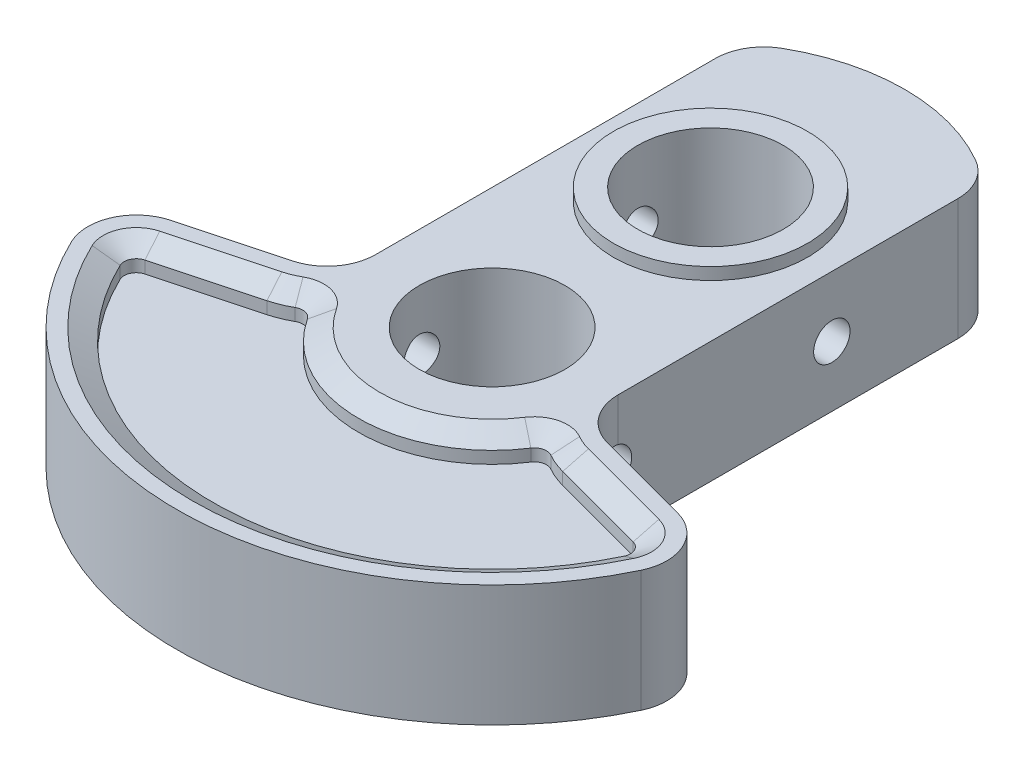
from build123d import *
from OCP.BRepFilletAPI import BRepFilletAPI_MakeChamfer

# Parameters (mm, degrees)
BOSS_EXTRUDE1_DEPTH     = 5
FILLET1_R               = 4
SKETCH2_R               = 8
BOSS_EXTRUDE2_DEPTH     = 1
SKETCH3_R               = 8
BOSS_EXTRUDE3_DEPTH     = 1
SKETCH4_R               = 6
CUT_EXTRUDE1_DEPTH      = 44.235891121
CUT_EXTRUDE2_DEPTH      = 2
CHAMFER1_SIZE           = 1
CHAMFER1_SIZE2          = 1.732050808
CHAMFER2_SIZE           = 1
CHAMFER2_SIZE2          = 1.732050808
CUT_EXTRUDE3_DEPTH      = 42.968348563
CUT_EXTRUDE3_DEPTH_BACK = 42.968348563
SKETCH6_R               = 1.5


with BuildPart() as part:
    # Sketch1 → Boss-Extrude1 (new, symmetric)
    with BuildSketch(Plane(origin=(0, 0, 0), x_dir=(1, 0, 0), z_dir=(0, 1, 0))):
        with BuildLine():
            Line((-10, 30.489995997), (-10, -2.679491924))
            Line((-10, -2.679491924), (-25.114071484, -6.729295173))
            ThreePointArc((-25.114071484, -6.729295173), (0, -26), (25.114071484, -6.729295173))
            Line((25.114071484, -6.729295173), (10, -2.679491924))
            Line((10, -2.679491924), (10, 30.489995997))
            ThreePointArc((10, 30.489995997), (0, 34), (-10, 30.489995997))
        make_face()
    extrude(amount=BOSS_EXTRUDE1_DEPTH, both=True)

    # Fillet1
    fillet1_edges = [part.edges().sort_by_distance(p)[0] for p in [
        (10, 0, -30.489995997),
        (10, 0, 2.679491924),
        (25.114071484, 0, 6.729295173),
        (-25.114071484, 0, 6.729295173),
        (-10, 0, 2.679491924),
        (-10, 0, -30.489995997),
    ]]
    fillet(fillet1_edges, radius=FILLET1_R)

    # Sketch2 → Boss-Extrude2 (add)
    with BuildSketch(Plane.XZ.offset(5)):
        with Locations(Location((0, 0, 0), (0, 0, 270))):
            Circle(SKETCH2_R)
    extrude(amount=BOSS_EXTRUDE2_DEPTH)

    # Sketch3 → Boss-Extrude3 (add)
    with BuildSketch(Plane(origin=(0, 5, 0), x_dir=(1, 0, 0), z_dir=(0, 1, 0))):
        with Locations(Location((0, 18, 0), (0, 0, 270))):
            Circle(SKETCH3_R)
    extrude(amount=BOSS_EXTRUDE3_DEPTH)

    # Sketch4 → Cut-Extrude1 (cut, through all)
    with BuildSketch(Plane.XZ.offset(6)):
        with Locations(Location((0, 0, 0), (0, 0, 270))):
            Circle(SKETCH4_R)
        with Locations(Location((0, -18, 0), (0, 0, 270))):
            Circle(SKETCH4_R)
    extrude(amount=-CUT_EXTRUDE1_DEPTH, mode=Mode.SUBTRACT)

    # Sketch5 → Cut-Extrude2 (cut)
    with BuildSketch(Plane(origin=(0, 5, 0), x_dir=(1, 0, 0), z_dir=(0, 1, 0))):
        with BuildLine():
            Line((12.188266684, -6.371664756), (20.119713435, -8.496889508))
            ThreePointArc((20.119713435, -8.496889508), (20.768948696, -9.043962883), (20.763662316, -9.892943304))
            ThreePointArc((20.763662316, -9.892943304), (0, -23), (-20.763662316, -9.892943304))
            ThreePointArc((-20.763662316, -9.892943304), (-20.768948696, -9.043962883), (-20.119713435, -8.496889508))
            Line((-20.119713435, -8.496889508), (-12.188266684, -6.371664756))
            ThreePointArc((-12.188266684, -6.371664756), (-11.342355786, -6.086056673), (-10.539679728, -5.695098402))
            ThreePointArc((-10.539679728, -5.695098402), (-9.810114884, -5.592432974), (-9.208235905, -6.017340901))
            ThreePointArc((-9.208235905, -6.017340901), (0, -11), (9.208235905, -6.017340901))
            ThreePointArc((9.208235905, -6.017340901), (9.810114884, -5.592432974), (10.539679728, -5.695098402))
            ThreePointArc((10.539679728, -5.695098402), (11.342355786, -6.086056673), (12.188266684, -6.371664756))
        make_face()
    cut_extrude2 = extrude(amount=-CUT_EXTRUDE2_DEPTH, mode=Mode.SUBTRACT)

    # Chamfer1: one chamfer whose edges measure the first distance from different faces: ONE call of the kernel's chamfer builder (chamfer() names one face for all edges)
    chamfer1_edges_1 = [part.edges().sort_by_distance(p)[0] for p in [
        (9.810114884, 5, 5.592432974),
    ]]
    chamfer1_side_1 = [part.faces().sort_by_distance(p)[0] for p in [
        (9.810114884, 4, 5.592432974),
    ]]
    chamfer1_edges_2 = [part.edges().sort_by_distance(p)[0] for p in [
        (0, 5, 11),
    ]]
    chamfer1_side_2 = [part.faces().sort_by_distance(p)[0] for p in [
        (0, 4, 11),
    ]]
    chamfer1_edges_3 = [part.edges().sort_by_distance(p)[0] for p in [
        (-9.810114884, 5, 5.592432974),
    ]]
    chamfer1_side_3 = [part.faces().sort_by_distance(p)[0] for p in [
        (-9.810114884, 4, 5.592432974),
    ]]
    chamfer1_edges_4 = [part.edges().sort_by_distance(p)[0] for p in [
        (-11.342355786, 5, 6.086056673),
    ]]
    chamfer1_side_4 = [part.faces().sort_by_distance(p)[0] for p in [
        (-11.342355786, 4, 6.086056673),
    ]]
    chamfer1_edges_5 = [part.edges().sort_by_distance(p)[0] for p in [
        (-16.153990059, 5, 7.434277132),
    ]]
    chamfer1_side_5 = [part.faces().sort_by_distance(p)[0] for p in [
        (-16.153990059, 4, 7.434277132),
    ]]
    chamfer1_edges_6 = [part.edges().sort_by_distance(p)[0] for p in [
        (-20.768948696, 5, 9.043962883),
    ]]
    chamfer1_side_6 = [part.faces().sort_by_distance(p)[0] for p in [
        (-20.768948696, 4, 9.043962883),
    ]]
    chamfer1_edges_7 = [part.edges().sort_by_distance(p)[0] for p in [
        (0, 5, 23),
    ]]
    chamfer1_side_7 = [part.faces().sort_by_distance(p)[0] for p in [
        (0, 4, 23),
    ]]
    chamfer1_edges_8 = [part.edges().sort_by_distance(p)[0] for p in [
        (20.768948696, 5, 9.043962883),
    ]]
    chamfer1_side_8 = [part.faces().sort_by_distance(p)[0] for p in [
        (20.768948696, 4, 9.043962883),
    ]]
    chamfer1_edges_9 = [part.edges().sort_by_distance(p)[0] for p in [
        (16.153990059, 5, 7.434277132),
    ]]
    chamfer1_side_9 = [part.faces().sort_by_distance(p)[0] for p in [
        (16.153990059, 4, 7.434277132),
    ]]
    chamfer1_edges_10 = [part.edges().sort_by_distance(p)[0] for p in [
        (11.342355786, 5, 6.086056673),
    ]]
    chamfer1_side_10 = [part.faces().sort_by_distance(p)[0] for p in [
        (11.342355786, 4, 6.086056673),
    ]]
    chamfer1 = BRepFilletAPI_MakeChamfer(part.part.solid().wrapped)
    for e in chamfer1_edges_1:
        chamfer1.Add(CHAMFER1_SIZE, CHAMFER1_SIZE2, e.wrapped, chamfer1_side_1[0].wrapped)  # the first distance lies on this face
    for e in chamfer1_edges_2:
        chamfer1.Add(CHAMFER1_SIZE, CHAMFER1_SIZE2, e.wrapped, chamfer1_side_2[0].wrapped)  # the first distance lies on this face
    for e in chamfer1_edges_3:
        chamfer1.Add(CHAMFER1_SIZE, CHAMFER1_SIZE2, e.wrapped, chamfer1_side_3[0].wrapped)  # the first distance lies on this face
    for e in chamfer1_edges_4:
        chamfer1.Add(CHAMFER1_SIZE, CHAMFER1_SIZE2, e.wrapped, chamfer1_side_4[0].wrapped)  # the first distance lies on this face
    for e in chamfer1_edges_5:
        chamfer1.Add(CHAMFER1_SIZE, CHAMFER1_SIZE2, e.wrapped, chamfer1_side_5[0].wrapped)  # the first distance lies on this face
    for e in chamfer1_edges_6:
        chamfer1.Add(CHAMFER1_SIZE, CHAMFER1_SIZE2, e.wrapped, chamfer1_side_6[0].wrapped)  # the first distance lies on this face
    for e in chamfer1_edges_7:
        chamfer1.Add(CHAMFER1_SIZE, CHAMFER1_SIZE2, e.wrapped, chamfer1_side_7[0].wrapped)  # the first distance lies on this face
    for e in chamfer1_edges_8:
        chamfer1.Add(CHAMFER1_SIZE, CHAMFER1_SIZE2, e.wrapped, chamfer1_side_8[0].wrapped)  # the first distance lies on this face
    for e in chamfer1_edges_9:
        chamfer1.Add(CHAMFER1_SIZE, CHAMFER1_SIZE2, e.wrapped, chamfer1_side_9[0].wrapped)  # the first distance lies on this face
    for e in chamfer1_edges_10:
        chamfer1.Add(CHAMFER1_SIZE, CHAMFER1_SIZE2, e.wrapped, chamfer1_side_10[0].wrapped)  # the first distance lies on this face
    add(Compound.cast(chamfer1.Shape()), mode=Mode.REPLACE)

    # Mirror5: Cut-Extrude2 across plane
    add(cut_extrude2.mirror(Plane.ZX), mode=Mode.SUBTRACT)

    # Chamfer2: one chamfer whose edges measure the first distance from different faces: ONE call of the kernel's chamfer builder (chamfer() names one face for all edges)
    chamfer2_edges_1 = [part.edges().sort_by_distance(p)[0] for p in [
        (9.810114884, -5, 5.592432974),
    ]]
    chamfer2_side_1 = [part.faces().sort_by_distance(p)[0] for p in [
        (9.810114884, -4, 5.592432974),
    ]]
    chamfer2_edges_2 = [part.edges().sort_by_distance(p)[0] for p in [
        (0, -5, 11),
    ]]
    chamfer2_side_2 = [part.faces().sort_by_distance(p)[0] for p in [
        (0, -4, 11),
    ]]
    chamfer2_edges_3 = [part.edges().sort_by_distance(p)[0] for p in [
        (-9.810114884, -5, 5.592432974),
    ]]
    chamfer2_side_3 = [part.faces().sort_by_distance(p)[0] for p in [
        (-9.810114884, -4, 5.592432974),
    ]]
    chamfer2_edges_4 = [part.edges().sort_by_distance(p)[0] for p in [
        (-11.342355786, -5, 6.086056673),
    ]]
    chamfer2_side_4 = [part.faces().sort_by_distance(p)[0] for p in [
        (-11.342355786, -4, 6.086056673),
    ]]
    chamfer2_edges_5 = [part.edges().sort_by_distance(p)[0] for p in [
        (-16.153990059, -5, 7.434277132),
    ]]
    chamfer2_side_5 = [part.faces().sort_by_distance(p)[0] for p in [
        (-16.153990059, -4, 7.434277132),
    ]]
    chamfer2_edges_6 = [part.edges().sort_by_distance(p)[0] for p in [
        (-20.768948696, -5, 9.043962883),
    ]]
    chamfer2_side_6 = [part.faces().sort_by_distance(p)[0] for p in [
        (-20.768948696, -4, 9.043962883),
    ]]
    chamfer2_edges_7 = [part.edges().sort_by_distance(p)[0] for p in [
        (0, -5, 23),
    ]]
    chamfer2_side_7 = [part.faces().sort_by_distance(p)[0] for p in [
        (0, -4, 23),
    ]]
    chamfer2_edges_8 = [part.edges().sort_by_distance(p)[0] for p in [
        (20.768948696, -5, 9.043962883),
    ]]
    chamfer2_side_8 = [part.faces().sort_by_distance(p)[0] for p in [
        (20.768948696, -4, 9.043962883),
    ]]
    chamfer2_edges_9 = [part.edges().sort_by_distance(p)[0] for p in [
        (16.153990059, -5, 7.434277132),
    ]]
    chamfer2_side_9 = [part.faces().sort_by_distance(p)[0] for p in [
        (16.153990059, -4, 7.434277132),
    ]]
    chamfer2_edges_10 = [part.edges().sort_by_distance(p)[0] for p in [
        (11.342355786, -5, 6.086056673),
    ]]
    chamfer2_side_10 = [part.faces().sort_by_distance(p)[0] for p in [
        (11.342355786, -4, 6.086056673),
    ]]
    chamfer2 = BRepFilletAPI_MakeChamfer(part.part.solid().wrapped)
    for e in chamfer2_edges_1:
        chamfer2.Add(CHAMFER2_SIZE, CHAMFER2_SIZE2, e.wrapped, chamfer2_side_1[0].wrapped)  # the first distance lies on this face
    for e in chamfer2_edges_2:
        chamfer2.Add(CHAMFER2_SIZE, CHAMFER2_SIZE2, e.wrapped, chamfer2_side_2[0].wrapped)  # the first distance lies on this face
    for e in chamfer2_edges_3:
        chamfer2.Add(CHAMFER2_SIZE, CHAMFER2_SIZE2, e.wrapped, chamfer2_side_3[0].wrapped)  # the first distance lies on this face
    for e in chamfer2_edges_4:
        chamfer2.Add(CHAMFER2_SIZE, CHAMFER2_SIZE2, e.wrapped, chamfer2_side_4[0].wrapped)  # the first distance lies on this face
    for e in chamfer2_edges_5:
        chamfer2.Add(CHAMFER2_SIZE, CHAMFER2_SIZE2, e.wrapped, chamfer2_side_5[0].wrapped)  # the first distance lies on this face
    for e in chamfer2_edges_6:
        chamfer2.Add(CHAMFER2_SIZE, CHAMFER2_SIZE2, e.wrapped, chamfer2_side_6[0].wrapped)  # the first distance lies on this face
    for e in chamfer2_edges_7:
        chamfer2.Add(CHAMFER2_SIZE, CHAMFER2_SIZE2, e.wrapped, chamfer2_side_7[0].wrapped)  # the first distance lies on this face
    for e in chamfer2_edges_8:
        chamfer2.Add(CHAMFER2_SIZE, CHAMFER2_SIZE2, e.wrapped, chamfer2_side_8[0].wrapped)  # the first distance lies on this face
    for e in chamfer2_edges_9:
        chamfer2.Add(CHAMFER2_SIZE, CHAMFER2_SIZE2, e.wrapped, chamfer2_side_9[0].wrapped)  # the first distance lies on this face
    for e in chamfer2_edges_10:
        chamfer2.Add(CHAMFER2_SIZE, CHAMFER2_SIZE2, e.wrapped, chamfer2_side_10[0].wrapped)  # the first distance lies on this face
    add(Compound.cast(chamfer2.Shape()), mode=Mode.REPLACE)

    # Sketch6 → Cut-Extrude3 (cut, two sides: drawn at the far end of the back side and taken through both)
    with BuildSketch(Plane(origin=(0, 0, 0), x_dir=(0, 0, -1), z_dir=(1, 0, 0)).offset(-CUT_EXTRUDE3_DEPTH_BACK)):
        Circle(SKETCH6_R)
        with Locations((18, 0)):
            Circle(SKETCH6_R)
    extrude(amount=CUT_EXTRUDE3_DEPTH + CUT_EXTRUDE3_DEPTH_BACK, mode=Mode.SUBTRACT)


solid = part.part
